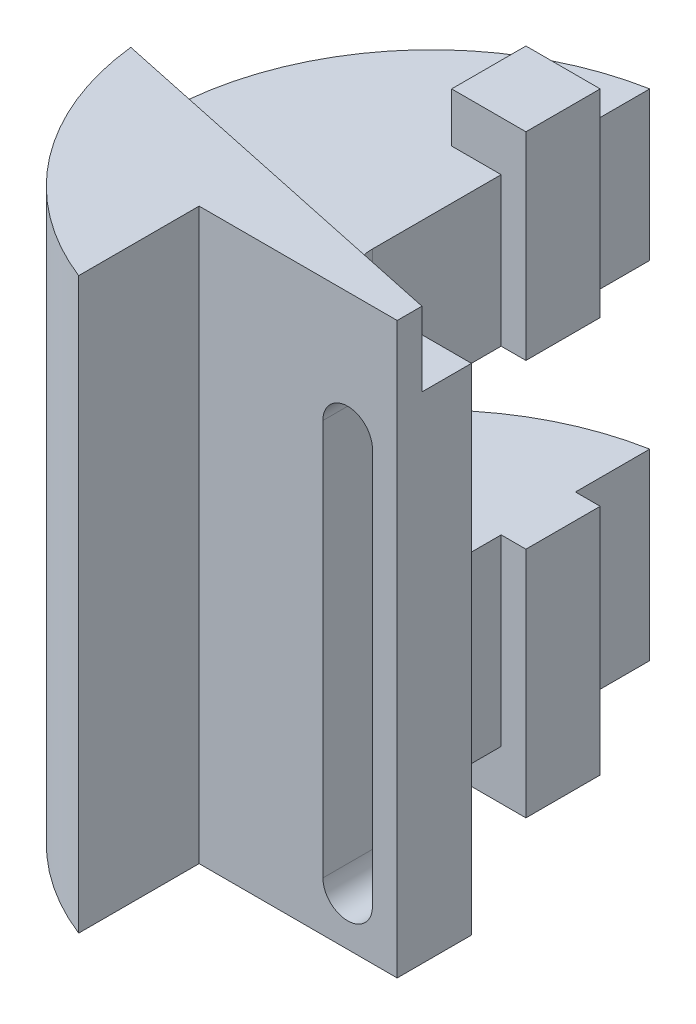
from build123d import *

# Parameters (mm, degrees)
BOSS_EXTRUDE4_DEPTH = 50
SKETCH1_7_W         = 15
SKETCH1_7_H         = 15
BOSS_EXTRUDE5_DEPTH = 60
SKETCH5_W           = 40
SKETCH5_H           = 33
CUT_EXTRUDE1_DEPTH  = 120
BOSS_EXTRUDE6_START = 15
BOSS_EXTRUDE6_DEPTH = 15
CUT_EXTRUDE3_DEPTH  = 67


with BuildPart() as part:
    # Sketch1 → Boss-Extrude4 (new, symmetric)
    with BuildSketch(Plane(origin=(0, 0, 0), x_dir=(1, 0, 0), z_dir=(0, 1, 0))):
        with BuildLine():
            Line((0, 0), (0, 15))
            Line((0, 15), (-20, 15))
            ThreePointArc((-20, 15), (-27.071067812, 17.928932188), (-30, 25))
            Line((-30, 25), (-30, 51))
            Line((-30, 51), (-40, 51))
            Line((-40, 51), (-40, 66))
            Line((-40, 66), (-30, 66))
            Line((-30, 66), (-30, 81))
            ThreePointArc((-30, 81), (-74.753734942, 32.115625929), (-40, -24.318022962))
            Line((-40, -24.318022962), (-40, 0))
            Line((-40, 0), (0, 0))
        make_face()
    extrude(amount=BOSS_EXTRUDE4_DEPTH, both=True)

    # Sketch1<7> → Boss-Extrude5 (add, symmetric)
    with BuildSketch(Plane(origin=(0, 0, 0), x_dir=(1, 0, 0), z_dir=(0, 1, 0))):
        with Locations((-32.5, 58.5)):
            Rectangle(SKETCH1_7_W, SKETCH1_7_H)
    extrude(amount=BOSS_EXTRUDE5_DEPTH, both=True)

    # Sketch5 → Cut-Extrude1 (cut)
    with BuildSketch(Plane(origin=(0, 0, 0), x_dir=(0, 0, -1), z_dir=(1, 0, 0))):
        with Locations((61, 3.5)):
            Rectangle(SKETCH5_W, SKETCH5_H)
    extrude(amount=-CUT_EXTRUDE1_DEPTH, mode=Mode.SUBTRACT)

    # Sketch6 → Boss-Extrude6 (add)
    with BuildSketch(Plane(origin=(0, 50, 0), x_dir=(1, 0, 0), z_dir=(0, 1, 0)).offset(BOSS_EXTRUDE6_START)):
        with BuildLine():
            Line((0, 5), (-74.666698166, 20.870896633))
            ThreePointArc((-74.666698166, 20.870896633), (-63.638154949, -6.560297565), (-40, -24.318022962))
            Line((-40, -24.318022962), (-40, 0))
            Line((-40, 0), (0, 0))
            Line((0, 0), (0, 5))
        make_face()
    extrude(amount=-BOSS_EXTRUDE6_DEPTH)

    # Sketch8 → Cut-Extrude3 (cut)
    with BuildSketch(Plane(origin=(0, 0, -15), x_dir=(-1, 0, 0), z_dir=(0, 0, -1))):
        with BuildLine():
            Line((15, 40), (15, -40))
            ThreePointArc((15, -40), (10, -45), (5, -40))
            Line((5, -40), (5, 40))
            ThreePointArc((5, 40), (10, 45), (15, 40))
        make_face()
    extrude(amount=-CUT_EXTRUDE3_DEPTH, mode=Mode.SUBTRACT)


solid = part.part
